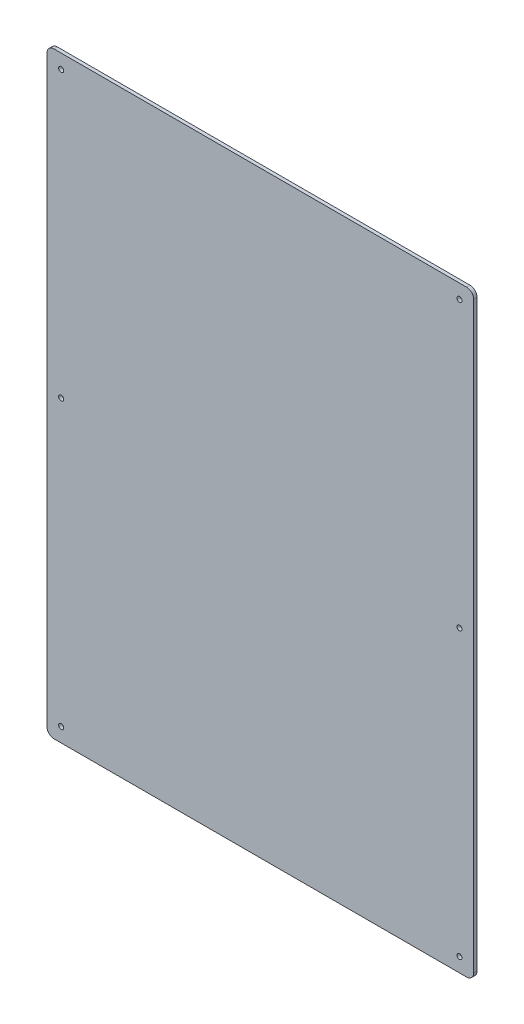
from build123d import *

# Parameters (mm, degrees)
SKETCH1_W                 = 381
SKETCH1_H                 = 533.4
BOSS_EXTRUDE1_DEPTH       = 3.048
FILLET1_R                 = 6.35
F_8_CLEARANCE_SLOT1_D     = 4.4958
F_8_CLEARANCE_SLOT1_DEPTH = 9.652
F_8_CLEARANCE_SLOT1_TIP   = 1.350674586


with BuildPart() as part:
    # Sketch1 → Boss-Extrude1 (new body)
    with BuildSketch(Plane.XY):
        with Locations((181.562957728, -259.506034901)):
            Rectangle(SKETCH1_W, SKETCH1_H)
    extrude(amount=BOSS_EXTRUDE1_DEPTH)

    # Fillet1
    fillet1_edges = [part.edges().sort_by_distance(p)[0] for p in [
        (-8.937042272, 7.193965099, 1.524),
        (372.062957728, 7.193965099, 1.524),
        (372.062957728, -526.206034901, 1.524),
        (-8.937042272, -526.206034901, 1.524),
    ]]
    fillet(fillet1_edges, radius=FILLET1_R)

    # #8 Clearance Slot1
    with Locations(Plane.XY.offset(3.048)):
        with Locations((3.762957728, -5.506034901), (3.762957728, -259.506034901), (3.762957728, -513.506034901), (359.362957728, -513.506034901), (359.362957728, -259.506034901), (359.362957728, -5.506034901)):
            Hole(F_8_CLEARANCE_SLOT1_D / 2, depth=F_8_CLEARANCE_SLOT1_DEPTH)
            with Locations((0, 0, -(F_8_CLEARANCE_SLOT1_DEPTH + F_8_CLEARANCE_SLOT1_TIP / 2))):  # 118° drill point
                Cone(0, F_8_CLEARANCE_SLOT1_D / 2, F_8_CLEARANCE_SLOT1_TIP, mode=Mode.SUBTRACT)


solid = part.part
